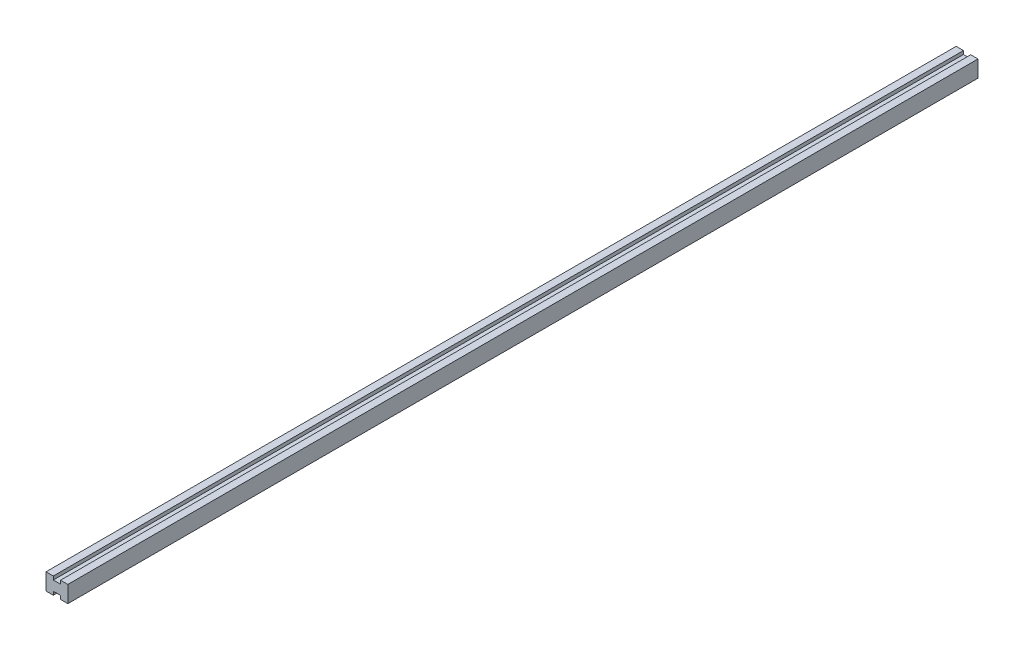
from build123d import *

# Parameters (mm, degrees)
BOSS_EXTRUDE1_DEPTH = 300


with BuildPart() as part:
    # Sketch1 → Boss-Extrude1 (new body)
    with BuildSketch(Plane.XY):
        Polygon((-1.2, 2.75), (-3.6, 2.75), (-3.6, -2.75), (-1.2, -2.75), (-1.2, -1.6), (1.2, -1.6), (1.2, -2.75), (3.6, -2.75), (3.6, 2.75), (1.2, 2.75), (1.2, 1.6), (-1.2, 1.6), align=None)
    extrude(amount=BOSS_EXTRUDE1_DEPTH)


solid = part.part
